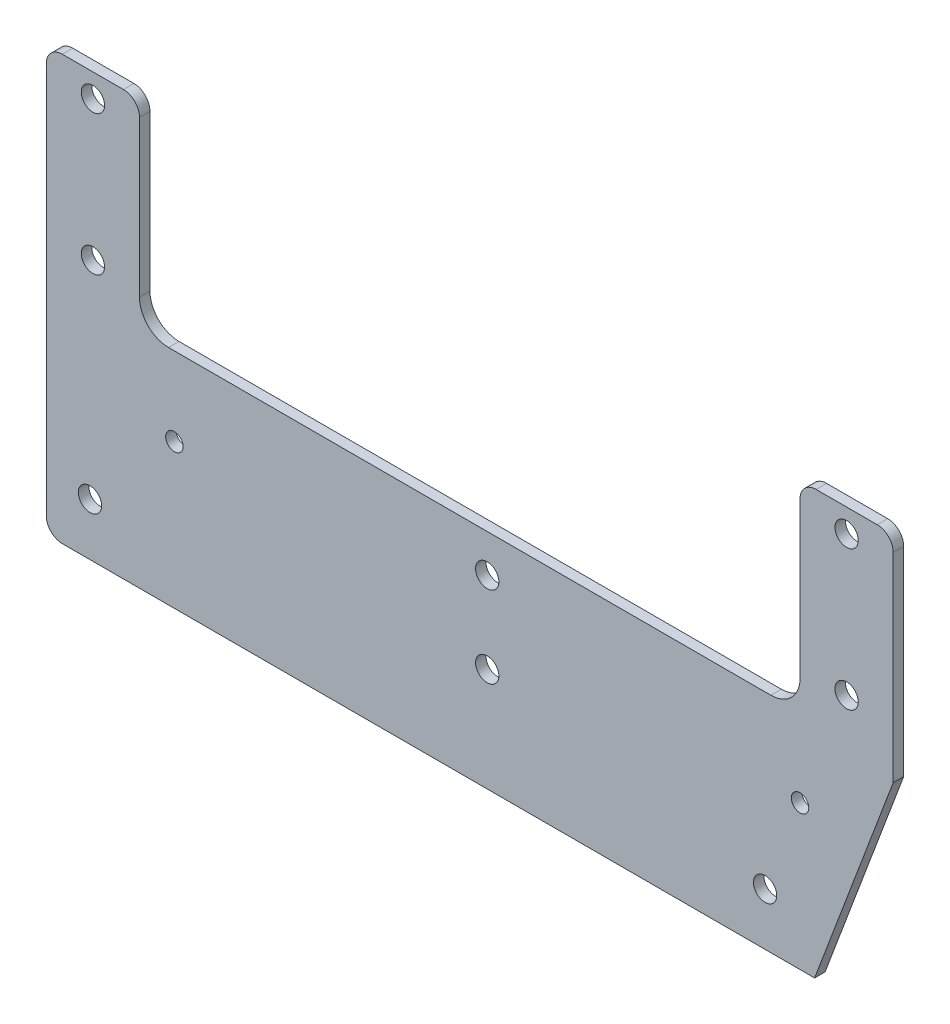
from build123d import *

# Parameters (mm, degrees)
SKETCH_1_R      = 1.5
SKETCH_1_R_2    = 2
EXTRUDE_1_DEPTH = 1.8
FILLET_1_R      = 2.75
FILLET_2_R      = 5


with BuildPart() as part:
    # 草图1 → 凸台-拉伸1 (new body)
    with BuildSketch(Plane.XY):
        Polygon((-22, -24.8), (109.95, -24.8), (123.45, 11), (123.45, 48), (107.45, 48), (107.45, 13.5), (-6, 13.5), (-6, 48), (-22, 48), align=None)
        Circle(SKETCH_1_R, mode=Mode.SUBTRACT)
        with Locations((107.45, 0)):
            Circle(SKETCH_1_R, mode=Mode.SUBTRACT)
        with Locations((115.45, 20)):
            Circle(SKETCH_1_R_2, mode=Mode.SUBTRACT)
        with Locations((-14, 20)):
            Circle(SKETCH_1_R_2, mode=Mode.SUBTRACT)
        with Locations((-14.5, -15.8)):
            Circle(SKETCH_1_R_2, mode=Mode.SUBTRACT)
        with Locations((101.45, -15.8)):
            Circle(SKETCH_1_R_2, mode=Mode.SUBTRACT)
        with Locations((115.45, 44)):
            Circle(SKETCH_1_R_2, mode=Mode.SUBTRACT)
        with Locations((-14, 44)):
            Circle(SKETCH_1_R_2, mode=Mode.SUBTRACT)
        with Locations((53.725, 7)):
            Circle(SKETCH_1_R_2, mode=Mode.SUBTRACT)
        with Locations(Location((53.725, -7, 0), (0, 0, 180))):
            Circle(SKETCH_1_R_2, mode=Mode.SUBTRACT)
    extrude(amount=EXTRUDE_1_DEPTH)

    # 圆角1
    fillet_1_edges = [part.edges().sort_by_distance(p)[0] for p in [
        (-22, 48, 0.9),
        (-6, 48, 0.9),
        (107.45, 48, 0.9),
        (123.45, 48, 0.9),
        (-22, -24.8, 0.9),
    ]]
    fillet(fillet_1_edges, radius=FILLET_1_R)

    # 圆角2
    fillet_2_edges = [part.edges().sort_by_distance(p)[0] for p in [
        (-6, 13.5, 0.9),
        (107.45, 13.5, 0.9),
    ]]
    fillet(fillet_2_edges, radius=FILLET_2_R)


solid = part.part
